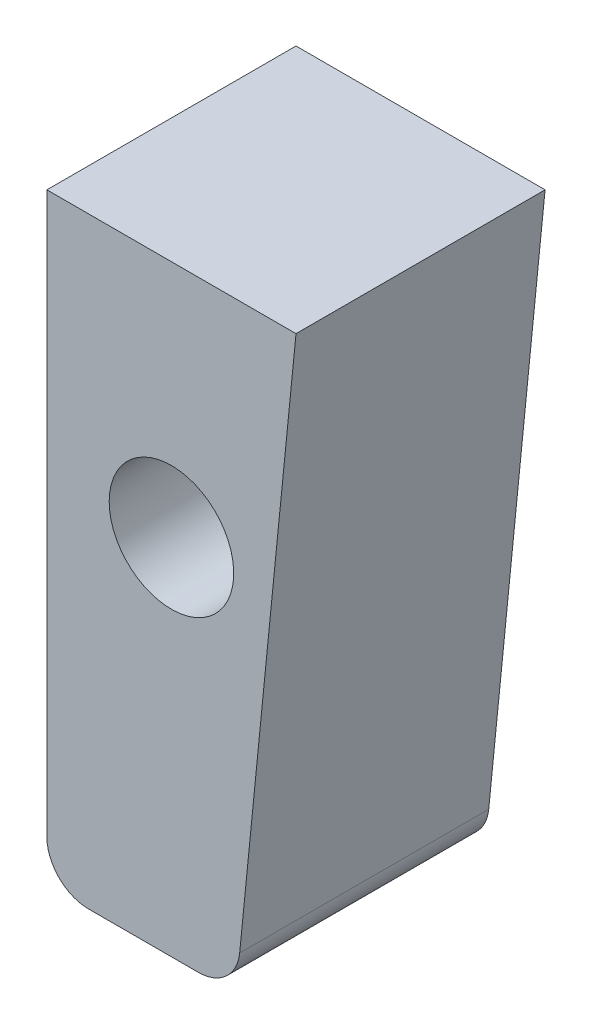
from build123d import *

# Parameters (mm, degrees)
SKETCH1_W           = 304.8
SKETCH1_H           = 304.8
BOSS_EXTRUDE1_DEPTH = 736.6
CUT_EXTRUDE1_REACH  = 855.455
SKETCH2_R           = 76.2
FILLET1_R           = 50.8


with BuildPart() as part:
    # Sketch1 → Boss-Extrude1 (new body)
    with BuildSketch(Plane(origin=(0, 0, 0), x_dir=(1, 0, 0), z_dir=(0, 1, 0))):
        with Locations((152.4, 152.4)):
            Rectangle(SKETCH1_W, SKETCH1_H)
    extrude(amount=BOSS_EXTRUDE1_DEPTH)

    # Sketch2 → Cut-Extrude1 (cut, up to next)
    with BuildSketch(Plane(origin=(0, 0, -304.8), x_dir=(-1, 0, 0), z_dir=(0, 0, -1)), mode=Mode.PRIVATE) as cut_extrude1_sk1:
        with Locations((-152.4, 444.5)):
            Circle(SKETCH2_R)
    cut_extrude1_tool1 = extrude(cut_extrude1_sk1.sketch, amount=-CUT_EXTRUDE1_REACH, mode=Mode.PRIVATE) & part.part
    # Sketch2 → Cut-Extrude1 (cut, up to next)
    with BuildSketch(Plane(origin=(0, 0, -304.8), x_dir=(-1, 0, 0), z_dir=(0, 0, -1)), mode=Mode.PRIVATE) as cut_extrude1_sk2:
        Polygon((-304.8, 736.6), (-231.279579983, 0), (-304.8, 0), align=None)
    cut_extrude1_tool2 = extrude(cut_extrude1_sk2.sketch, amount=-CUT_EXTRUDE1_REACH, mode=Mode.PRIVATE) & part.part
    add(cut_extrude1_tool1.solids().sort_by_distance((152.4, 444.5, -304.8))[0], mode=Mode.SUBTRACT)
    add(cut_extrude1_tool2.solids().sort_by_distance((280.293193, 245.533333, -304.8))[0], mode=Mode.SUBTRACT)

    # Fillet1
    fillet1_edges = [part.edges().sort_by_distance(p)[0] for p in [
        (231.279579983, 0, -152.4),
        (0, 0, -152.4),
    ]]
    fillet(fillet1_edges, radius=FILLET1_R)


solid = part.part
